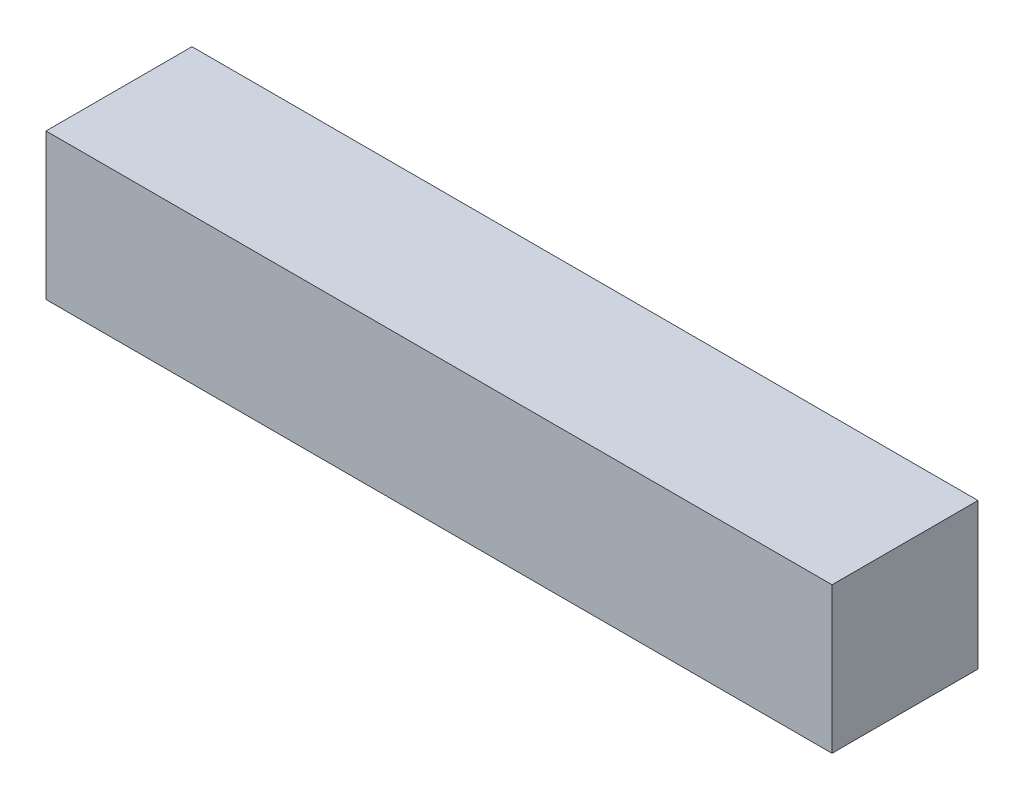
from build123d import *

# Parameters (mm, degrees)
SKETCH1_W           = 14
SKETCH1_H           = 2.6
BOSS_EXTRUDE1_DEPTH = 2.6


with BuildPart() as part:
    # Sketch1 → Boss-Extrude1 (new body)
    with BuildSketch(Plane.XY):
        Rectangle(SKETCH1_W, SKETCH1_H)
    extrude(amount=BOSS_EXTRUDE1_DEPTH)


solid = part.part
